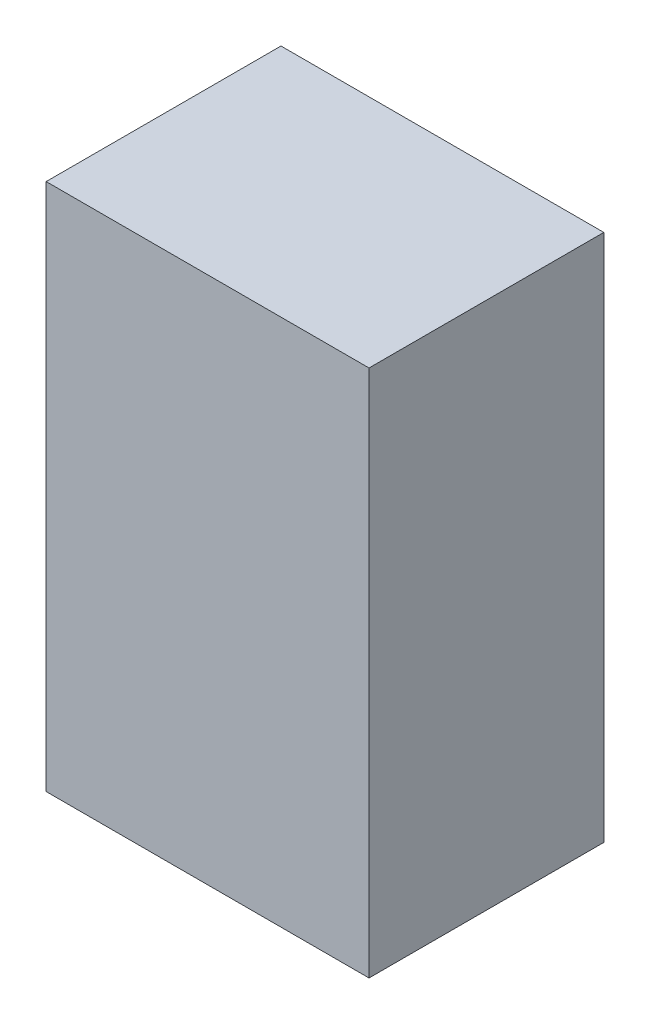
from build123d import *

# Parameters (mm, degrees)
SKETCH1_W           = 45.72
SKETCH1_H           = 81.28
BOSS_EXTRUDE1_DEPTH = 7.62
SKETCH7_W           = 40.64
SKETCH7_H           = 81.28
BOSS_EXTRUDE3_DEPTH = 5.08
SKETCH8_W           = 40.64
SKETCH8_H           = 81.28
BOSS_EXTRUDE4_DEPTH = 5.08
SKETCH9_W           = 55.88
SKETCH9_H           = 40.64
BOSS_EXTRUDE5_DEPTH = 5.08
SKETCH10_W          = 55.88
SKETCH10_H          = 40.64
BOSS_EXTRUDE6_DEPTH = 5.08


with BuildPart() as part:
    # Sketch1 → Boss-Extrude1 (new body)
    with BuildSketch(Plane.XY):
        with Locations((-26.67, -9.68375)):
            Rectangle(SKETCH1_W, SKETCH1_H)
    extrude(amount=BOSS_EXTRUDE1_DEPTH)

    # Sketch7 → Boss-Extrude3 (add)
    with BuildSketch(Plane.ZY.offset(49.53)):
        with Locations((-12.7, -9.68375)):
            Rectangle(SKETCH7_W, SKETCH7_H)
    extrude(amount=BOSS_EXTRUDE3_DEPTH)

    # Sketch8 → Boss-Extrude4 (add)
    with BuildSketch(Plane(origin=(-3.81, 0, 0), x_dir=(0, 0, -1), z_dir=(1, 0, 0))):
        with Locations((12.7, -9.68375)):
            Rectangle(SKETCH8_W, SKETCH8_H)
    extrude(amount=BOSS_EXTRUDE4_DEPTH)

    # Sketch9 → Boss-Extrude5 (add)
    with BuildSketch(Plane(origin=(0, 30.95625, 0), x_dir=(1, 0, 0), z_dir=(0, 1, 0))):
        with Locations((-26.67, 12.7)):
            Rectangle(SKETCH9_W, SKETCH9_H)
    extrude(amount=BOSS_EXTRUDE5_DEPTH)

    # Sketch10 → Boss-Extrude6 (add)
    with BuildSketch(Plane.XZ.offset(50.32375)):
        with Locations((-26.67, -12.7)):
            Rectangle(SKETCH10_W, SKETCH10_H)
    extrude(amount=BOSS_EXTRUDE6_DEPTH)


solid = part.part
